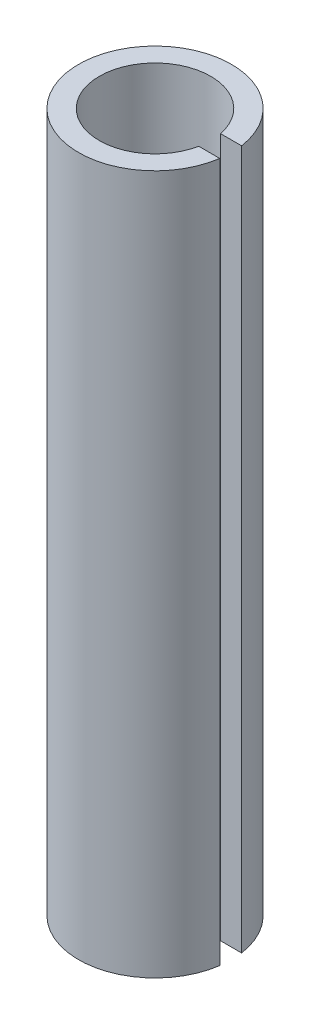
from build123d import *

# Parameters (mm, degrees)
BOSS_EXTRUDE1_DEPTH = 32


with BuildPart() as part:
    # Sketch1 → Boss-Extrude1 (new body)
    with BuildSketch(Plane(origin=(0, 0, 0), x_dir=(1, 0, 0), z_dir=(0, 1, 0))):
        with BuildLine():
            ThreePointArc((2.50049995, -0.5), (-2.55, 0), (2.50049995, 0.5))
            Line((2.50049995, 0.5), (3.464101615, 0.5))
            ThreePointArc((3.464101615, 0.5), (-3.5, 0), (3.464101615, -0.5))
            Line((3.464101615, -0.5), (2.50049995, -0.5))
        make_face()
    extrude(amount=BOSS_EXTRUDE1_DEPTH)


solid = part.part
